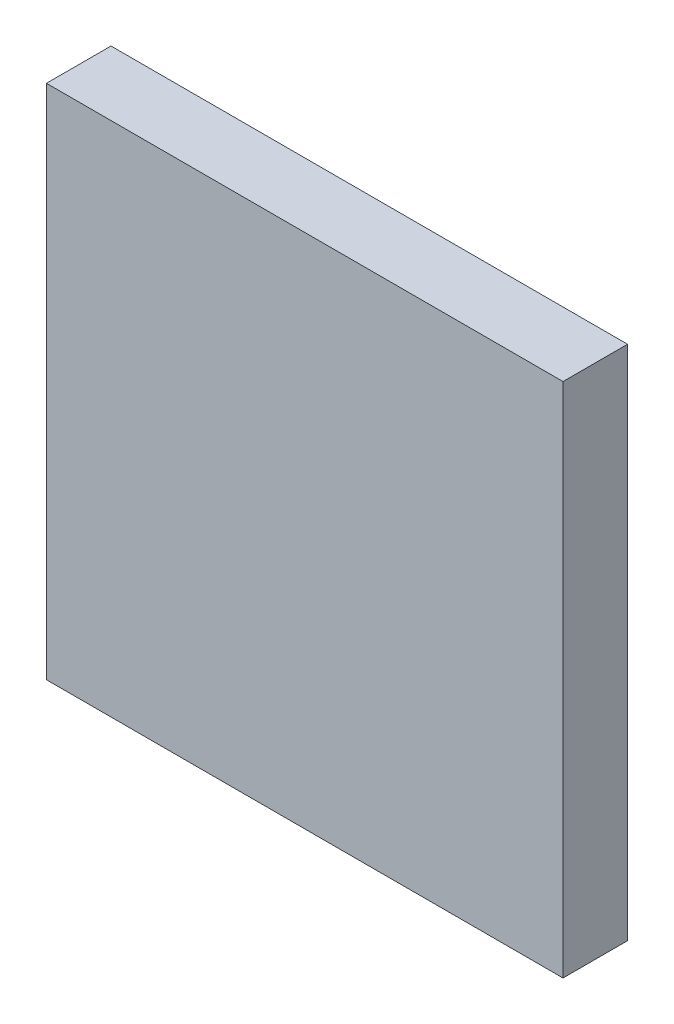
from build123d import *

# Parameters (mm, degrees)
ESQUISSE1_W        = 16
ESQUISSE1_H        = 16
BOSS_EXTRU_1_DEPTH = 2
ESQUISSE2_W        = 4
ESQUISSE2_H        = 4
BOSS_EXTRU_2_DEPTH = 4


with BuildPart() as part:
    # Esquisse1 → Boss.-Extru.1 (new body)
    with BuildSketch(Plane.XY):
        with Locations((8, 8)):
            Rectangle(ESQUISSE1_W, ESQUISSE1_H)
    extrude(amount=BOSS_EXTRU_1_DEPTH)

    # Esquisse2 → Boss.-Extru.2 (add)
    with BuildSketch(Plane(origin=(0, 0, 0), x_dir=(-1, 0, 0), z_dir=(0, 0, -1))):
        with Locations((-8, 8)):
            Rectangle(ESQUISSE2_W, ESQUISSE2_H)
    extrude(amount=BOSS_EXTRU_2_DEPTH)


solid = part.part
